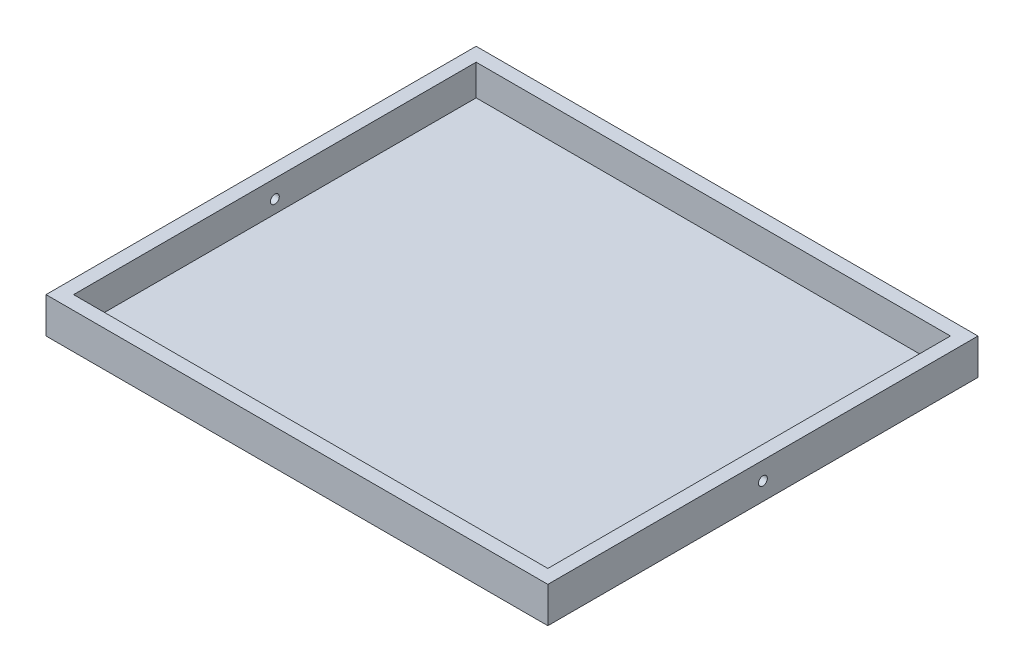
from build123d import *

# Parameters (mm, degrees)
SKETCH1_W           = 288.925
SKETCH1_H           = 247.65
SKETCH1_W_2         = 273.05
SKETCH1_H_2         = 231.775
BOSS_EXTRUDE1_DEPTH = 20.6375
SKETCH2_W           = 231.775
SKETCH2_H           = 2.839616755
BOSS_EXTRUDE2_DEPTH = 273.05
SKETCH3_R           = 2.54
CUT_EXTRUDE1_DEPTH  = 356.620697252


with BuildPart() as part:
    # Sketch1 → Boss-Extrude1 (new body)
    with BuildSketch(Plane(origin=(0, 0, 0), x_dir=(1, 0, 0), z_dir=(0, 1, 0))):
        with Locations((47.164436759, -82.481854668)):
            Rectangle(SKETCH1_W, SKETCH1_H)
        with Locations((47.164436759, -82.481854668)):
            Rectangle(SKETCH1_W_2, SKETCH1_H_2, mode=Mode.SUBTRACT)
    extrude(amount=BOSS_EXTRUDE1_DEPTH)

    # Sketch2 → Boss-Extrude2 (add)
    with BuildSketch(Plane(origin=(-89.360563241, 0, 0), x_dir=(0, 0, -1), z_dir=(1, 0, 0))):
        with Locations((-82.481854668, 1.419808378)):
            Rectangle(SKETCH2_W, SKETCH2_H)
    extrude(amount=BOSS_EXTRUDE2_DEPTH)

    # Sketch3 → Cut-Extrude1 (cut, through all)
    with BuildSketch(Plane(origin=(191.626936759, 0, 0), x_dir=(0, 0, -1), z_dir=(1, 0, 0))):
        with Locations((-82.481854668, 10.31875)):
            Circle(SKETCH3_R)
    extrude(amount=-CUT_EXTRUDE1_DEPTH, mode=Mode.SUBTRACT)


solid = part.part
